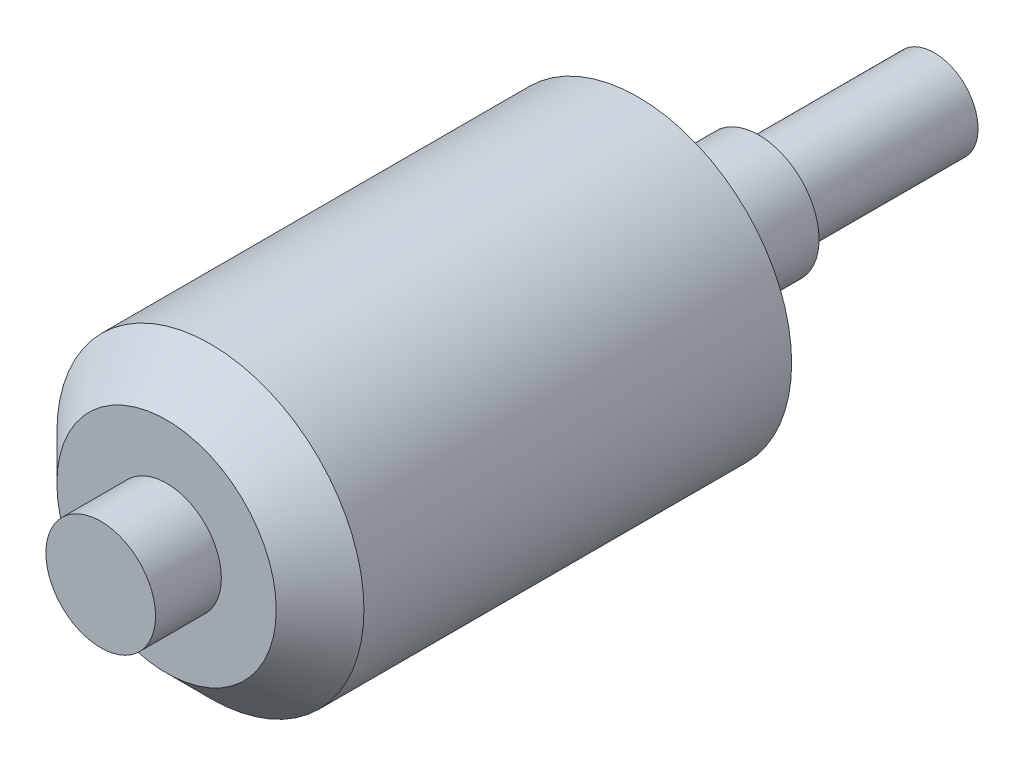
from build123d import *

# Parameters (mm, degrees)
ESQUISSE1_R             = 14
BOSS_EXTRU_1_DEPTH      = 43
CHANFREIN1_SIZE         = 4
ESQUISSE2_R             = 5
BOSS_EXTRU_2_DEPTH      = 6
ESQUISSE3_R             = 1.25
ENL_V_MAT_EXTRU_1_DEPTH = 10
ESQUISSE4_R             = 2.523074606
BOSS_EXTRU_3_DEPTH      = 4
ESQUISSE5_R             = 5.5
BOSS_EXTRU_4_DEPTH      = 7
ESQUISSE6_R             = 4
BOSS_EXTRU_5_DEPTH      = 16


with BuildPart() as part:
    # Esquisse1 → Boss.-Extru.1 (new body)
    with BuildSketch(Plane.XY):
        Circle(ESQUISSE1_R)
    extrude(amount=BOSS_EXTRU_1_DEPTH)

    # Chanfrein1
    chanfrein1_edges = [part.edges().sort_by_distance(p)[0] for p in [
        (-14, 0, 43),
    ]]
    chamfer(chanfrein1_edges, length=CHANFREIN1_SIZE)

    # Esquisse2 → Boss.-Extru.2 (add)
    with BuildSketch(Plane.XY.offset(43)):
        Circle(ESQUISSE2_R)
    extrude(amount=BOSS_EXTRU_2_DEPTH)

    # Esquisse3 → Enlèv. mat.-Extru.1 (cut)
    with BuildSketch(Plane(origin=(0, 0, 0), x_dir=(-1, 0, 0), z_dir=(0, 0, -1))):
        with Locations((0, 9.5)):
            Circle(ESQUISSE3_R)
        with Locations((9.5, 0)):
            Circle(ESQUISSE3_R)
        with Locations((0, -9.5)):
            Circle(ESQUISSE3_R)
        with Locations((-9.5, 0)):
            Circle(ESQUISSE3_R)
    extrude(amount=-ENL_V_MAT_EXTRU_1_DEPTH, mode=Mode.SUBTRACT)

    # Esquisse4 → Boss.-Extru.3 (add)
    with BuildSketch(Plane(origin=(0, 0, 0), x_dir=(-1, 0, 0), z_dir=(0, 0, -1))):
        with Locations(Location((0, 0, 0), (0, 0, 180))):
            Circle(ESQUISSE4_R)
    extrude(amount=BOSS_EXTRU_3_DEPTH)

    # Esquisse5 → Boss.-Extru.4 (add)
    with BuildSketch(Plane(origin=(0, 0, -4), x_dir=(-1, 0, 0), z_dir=(0, 0, -1))):
        Circle(ESQUISSE5_R)
    extrude(amount=BOSS_EXTRU_4_DEPTH)

    # Esquisse6 → Boss.-Extru.5 (add)
    with BuildSketch(Plane(origin=(0, 0, -11), x_dir=(-1, 0, 0), z_dir=(0, 0, -1))):
        Circle(ESQUISSE6_R)
    extrude(amount=BOSS_EXTRU_5_DEPTH)


solid = part.part
